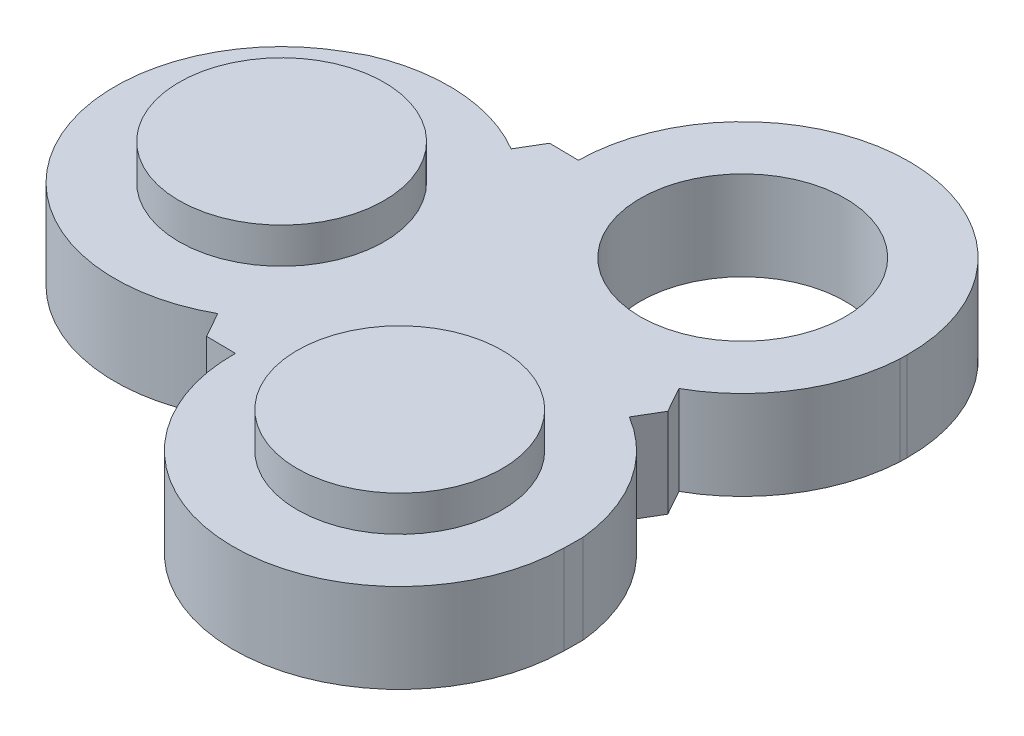
from build123d import *

# Parameters (mm, degrees)
SKETCH5_R                  = 30
BOSS_EXTRUDE1_DEPTH        = 5
SKETCH6_R                  = 5.75
CUT_EXTRUDE1_DEPTH         = 50
CUT_EXTRUDE_THIN1_DEPTH    = 50
BOSS_EXTRUDE2_DEPTH        = 2
BOSS_EXTRUDE2_DEPTH_BACK   = 2
SKETCH10_R                 = 5.75
BOSS_EXTRUDE2_2_DEPTH      = 2
BOSS_EXTRUDE2_2_DEPTH_BACK = 2


with BuildPart() as part:
    # Sketch5 → Boss-Extrude1 (new body)
    with BuildSketch(Plane(origin=(0, 0, 0), x_dir=(1, 0, 0), z_dir=(0, 1, 0))):
        with Locations(Location((0, 0, 0), (0, 0, 270))):
            Circle(SKETCH5_R)
    extrude(amount=BOSS_EXTRUDE1_DEPTH)

    # Sketch6 → Cut-Extrude1 (cut)
    with BuildSketch(Plane(origin=(0, 5, 0), x_dir=(1, 0, 0), z_dir=(0, 1, 0))):
        with Locations(Location((5.564652455, 9.430649132, 0), (0, 0, 270))):
            Circle(SKETCH6_R)
        with Locations(Location((5.325305202, -9.567843252, 0), (0, 0, 270))):
            Circle(SKETCH6_R)
        with Locations(Location((-11.00819821, 0.138683741, 0), (0, 0, 270))):
            Circle(SKETCH6_R)
    extrude(amount=-CUT_EXTRUDE1_DEPTH, mode=Mode.SUBTRACT)

    # Sketch9 → Cut-Extrude-Thin1 (cut)
    with BuildSketch(Plane(origin=(0, 5, 0), x_dir=(1, 0, 0), z_dir=(0, 1, 0))):
        with BuildLine():
            ThreePointArc((-3.76991423, 9.548248089), (5.682251411, 18.765215817), (14.899219139, 9.313050176))
            Line((14.899219139, 9.313050176), (14.659871887, -9.685442209))
            ThreePointArc((14.659871887, -9.685442209), (5.207706246, -18.902409937), (-4.009261482, -9.450244295))
            Line((-4.009261482, -9.450244295), (-14.008468, -9.324272058))
            ThreePointArc((-14.008468, -9.324272058), (5.081734008, -28.901616455), (24.659078405, -9.811414447))
            Line((24.659078405, -9.811414447), (24.898425657, 9.187077938))
            ThreePointArc((24.898425657, 9.187077938), (5.808223649, 28.764422335), (-13.769120748, 9.674220327))
            Line((-13.769120748, 9.674220327), (-3.76991423, 9.548248089))
        make_face()
        with BuildLine():
            ThreePointArc((10.124185438, -1.49260411), (13.400544345, -14.366723488), (0.526424967, -17.643082394))
            Line((0.526424967, -17.643082394), (-15.807078446, -7.936555401))
            ThreePointArc((-15.807078446, -7.936555401), (-19.083437352, 4.937563977), (-6.209317974, 8.213922883))
            Line((-6.209317974, 8.213922883), (-1.100619557, 16.810503626))
            ThreePointArc((-1.100619557, 16.810503626), (-27.680018096, 10.046262394), (-20.915776863, -16.533136145))
            Line((-20.915776863, -16.533136145), (-4.582273451, -26.239663138))
            ThreePointArc((-4.582273451, -26.239663138), (21.997125088, -19.475421905), (15.232883856, 7.103976633))
            Line((15.232883856, 7.103976633), (10.124185438, -1.49260411))
        make_face()
        with BuildLine():
            ThreePointArc((-6.438623457, -8.011462842), (-19.158344793, -4.430891012), (-15.577772963, 8.288830324))
            Line((-15.577772963, 8.288830324), (0.995077701, 17.580795716))
            ThreePointArc((0.995077701, 17.580795716), (13.714799038, 14.000223886), (10.134227208, 1.280502549))
            Line((10.134227208, 1.280502549), (15.024735309, -7.442050432))
            ThreePointArc((15.024735309, -7.442050432), (22.437352019, 18.890731987), (-3.8954304, 26.303348697))
            Line((-3.8954304, 26.303348697), (-20.468281064, 17.011383305))
            ThreePointArc((-20.468281064, 17.011383305), (-27.880897775, -9.321399113), (-1.548115356, -16.734015824))
            Line((-1.548115356, -16.734015824), (-6.438623457, -8.011462842))
        make_face()
    extrude(amount=-CUT_EXTRUDE_THIN1_DEPTH, mode=Mode.SUBTRACT)


with BuildPart() as cut_extrude_thin1_kept_piece:
    # of the separate pieces the step leaves, the one the design keeps (cut_extrude_thin1_pieces_kept)
    add(part.part.solids().sort_by_distance((-4.009261482, 0, 9.450244295))[0])


with BuildPart() as body_2:
    # Sketch10 → Boss-Extrude2 (new, two sides: drawn at the far end of the back side and taken through both)
    with BuildSketch(Plane(origin=(0, 5, 0), x_dir=(1, 0, 0), z_dir=(0, 1, 0)).offset(-BOSS_EXTRUDE2_DEPTH_BACK)):
        with Locations(Location((5.325305202, -9.567843252, 0), (0, 0, 270))):
            Circle(SKETCH10_R)
    extrude(amount=BOSS_EXTRUDE2_DEPTH + BOSS_EXTRUDE2_DEPTH_BACK)


with BuildPart() as body_3:
    # Sketch10 → Boss-Extrude2 2 (new, two sides: drawn at the far end of the back side and taken through both)
    with BuildSketch(Plane(origin=(0, 5, 0), x_dir=(1, 0, 0), z_dir=(0, 1, 0)).offset(-BOSS_EXTRUDE2_2_DEPTH_BACK)):
        with Locations(Location((-11.00819821, 0.138683741, 0), (0, 0, 270))):
            Circle(SKETCH10_R)
    extrude(amount=BOSS_EXTRUDE2_2_DEPTH + BOSS_EXTRUDE2_2_DEPTH_BACK)


solid = Compound([cut_extrude_thin1_kept_piece.part, body_2.part, body_3.part])
